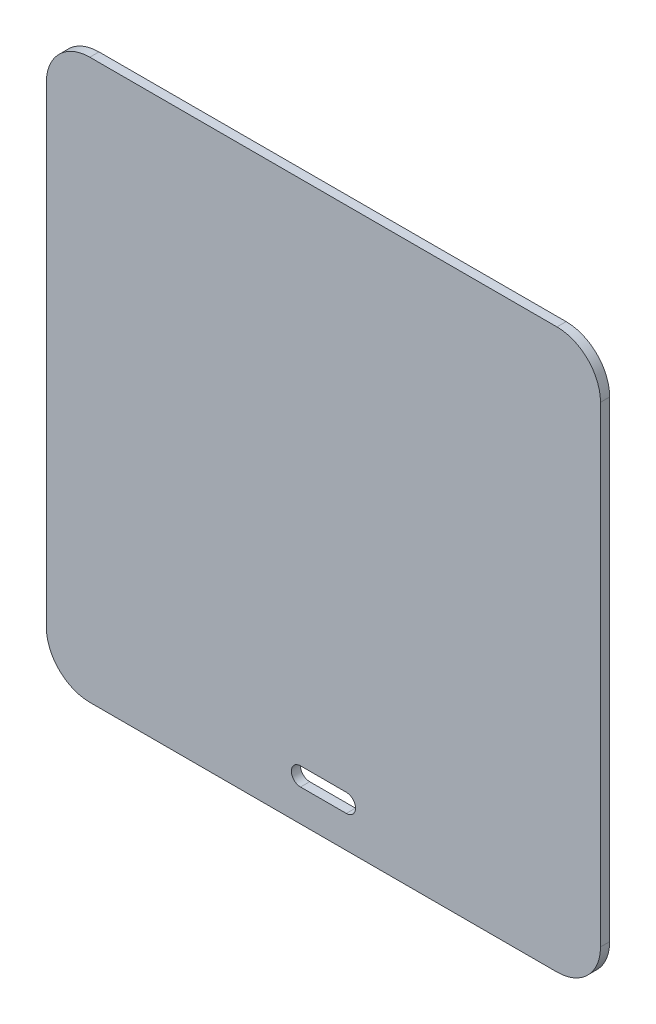
from build123d import *

# Parameters (mm, degrees)
EXTRUDE_3_DEPTH = 1


with BuildPart() as part:
    # 草图1 → 凸台-拉伸3 (new body)
    with BuildSketch(Plane.XY):
        with BuildLine():
            Line((-30.25, 25.75), (-30.25, -25.75))
            ThreePointArc((-30.25, -25.75), (-28.858757211, -29.108757211), (-25.5, -30.5))
            Line((-25.5, -30.5), (25.5, -30.5))
            ThreePointArc((25.5, -30.5), (28.858757211, -29.108757211), (30.25, -25.75))
            Line((30.25, -25.75), (30.25, 25.75))
            ThreePointArc((30.25, 25.75), (28.858757211, 29.108757211), (25.5, 30.5))
            Line((25.5, 30.5), (-25.5, 30.5))
            ThreePointArc((-25.5, 30.5), (-28.858757211, 29.108757211), (-30.25, 25.75))
        make_face()
        with BuildLine():
            Line((-2.5, -25), (2.5, -25))
            ThreePointArc((2.5, -25), (3.5, -26), (2.5, -27))
            Line((2.5, -27), (-2.5, -27))
            ThreePointArc((-2.5, -27), (-3.5, -26), (-2.5, -25))
        make_face(mode=Mode.SUBTRACT)
    extrude(amount=EXTRUDE_3_DEPTH)


solid = part.part
